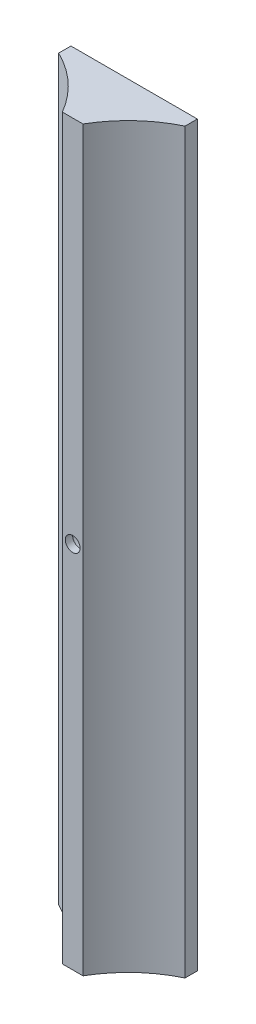
from build123d import *

# Parameters (mm, degrees)
BOSS_EXTRUDE1_DEPTH                       = 30
TAPPED_HOLE_FOR_M2_5X0_45_HELICOIL1_D     = 2.55
TAPPED_HOLE_FOR_M2_5X0_45_HELICOIL1_DEPTH = 4
TAPPED_HOLE_FOR_M2_5X0_45_HELICOIL1_TIP   = 0.766097289
F_1_2_1_2_DIAMETER_HOLE1_D                = 1.2
F_1_2_1_2_DIAMETER_HOLE1_DEPTH            = 6.45
F_1_2_1_2_DIAMETER_HOLE1_TIP              = 0.360516371


with BuildPart() as part:
    # Sketch1 → Boss-Extrude1 (new, symmetric)
    with BuildSketch(Plane(origin=(0, 0, 0), x_dir=(1, 0, 0), z_dir=(0, 1, 0))):
        with BuildLine():
            Line((-0.839745962, 0), (0.839745962, 0))
            ThreePointArc((0.839745962, 0), (2.690111154, 2.322937519), (5.141101056, 4))
            Line((5.141101056, 4), (5.141101056, 5))
            Line((5.141101056, 5), (-5.141101056, 5))
            Line((-5.141101056, 5), (-5.141101056, 4))
            ThreePointArc((-5.141101056, 4), (-2.690111154, 2.322937519), (-0.839745962, 0))
        make_face()
    extrude(amount=BOSS_EXTRUDE1_DEPTH, both=True)

    # Tapped Hole for M2.5x0.45 Helicoil1
    with Locations(Plane(origin=(0, 0, -5), x_dir=(-1, 0, 0), z_dir=(0, 0, -1))):
        with Locations((0, 0)):
            Hole(TAPPED_HOLE_FOR_M2_5X0_45_HELICOIL1_D / 2, depth=TAPPED_HOLE_FOR_M2_5X0_45_HELICOIL1_DEPTH)
            with Locations((0, 0, -(TAPPED_HOLE_FOR_M2_5X0_45_HELICOIL1_DEPTH + TAPPED_HOLE_FOR_M2_5X0_45_HELICOIL1_TIP / 2))):  # 118° drill point
                Cone(0, TAPPED_HOLE_FOR_M2_5X0_45_HELICOIL1_D / 2, TAPPED_HOLE_FOR_M2_5X0_45_HELICOIL1_TIP, mode=Mode.SUBTRACT)

    # Ø1.2 (1.2) Diameter Hole1
    with Locations(Plane(origin=(0, 0, -5), x_dir=(-1, 0, 0), z_dir=(0, 0, -1))):
        with Locations((0, 0)):
            Hole(F_1_2_1_2_DIAMETER_HOLE1_D / 2, depth=F_1_2_1_2_DIAMETER_HOLE1_DEPTH)
            with Locations((0, 0, -(F_1_2_1_2_DIAMETER_HOLE1_DEPTH + F_1_2_1_2_DIAMETER_HOLE1_TIP / 2))):  # 118° drill point
                Cone(0, F_1_2_1_2_DIAMETER_HOLE1_D / 2, F_1_2_1_2_DIAMETER_HOLE1_TIP, mode=Mode.SUBTRACT)


solid = part.part
